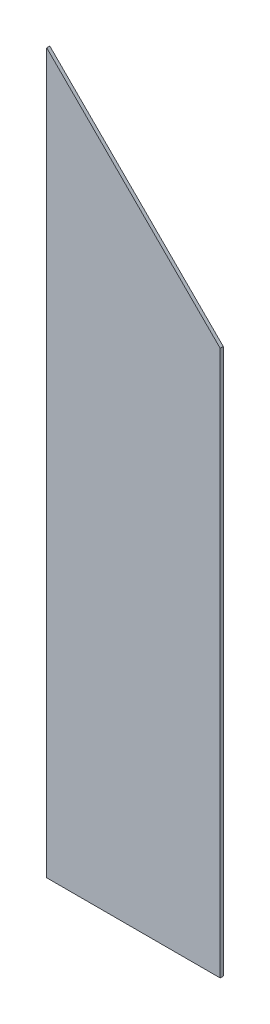
from build123d import *

# Parameters (mm, degrees)
BOSS_EXTRUDE1_DEPTH = 3.175


with BuildPart() as part:
    # Sketch1 → Boss-Extrude1 (new body)
    with BuildSketch(Plane.XY):
        Polygon((0, 0), (177.8, 0), (177.8, 558.8), (0, 736.6), align=None)
    extrude(amount=BOSS_EXTRUDE1_DEPTH)


solid = part.part
